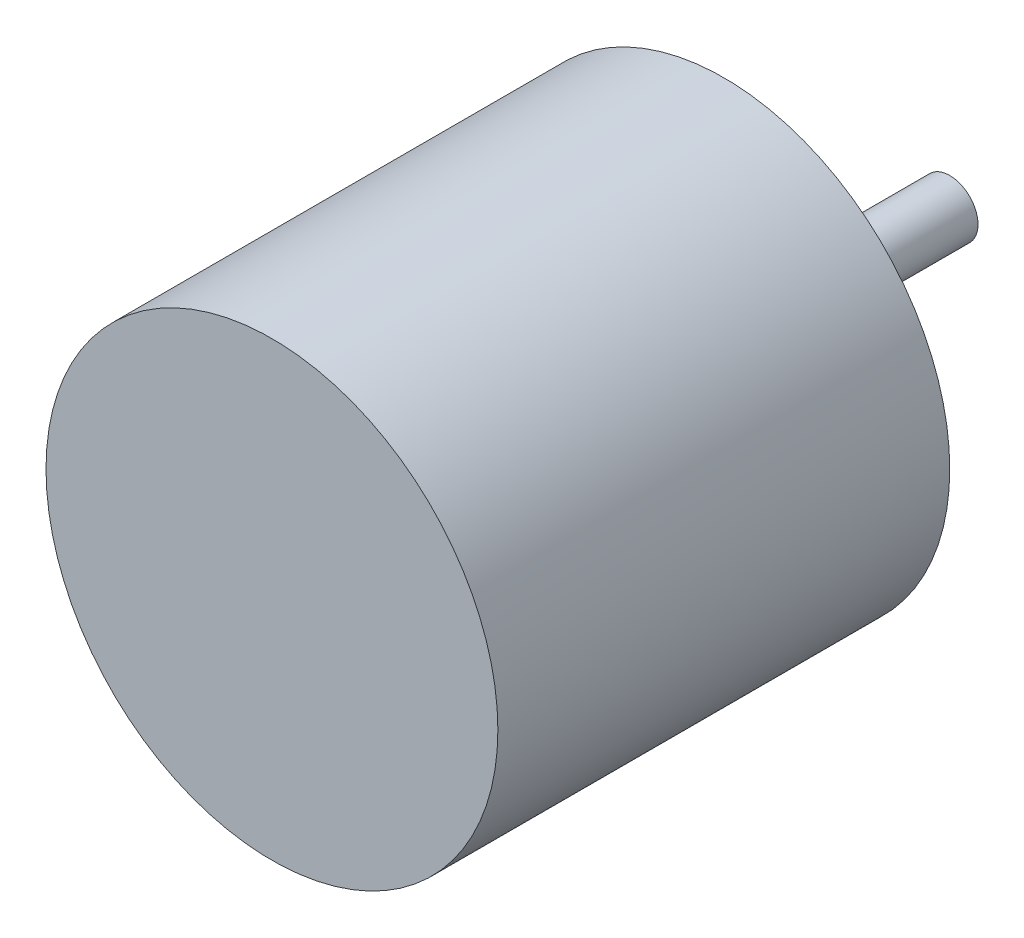
from build123d import *


with BuildPart() as part:
    # Sketch4 → Revolve1 (revolve)
    with BuildSketch(Plane(origin=(0, 0, 0), x_dir=(1, 0, 0), z_dir=(0, 1, 0)), mode=Mode.PRIVATE) as revolve1_sk:
        Polygon((0, 60), (-2.5, 60), (-2.5, 45), (-10, 45), (-10, 40), (-20, 40), (-20, 0), (0, 0), align=None)
    revolve(revolve1_sk.sketch.rotate(Axis((0, 0, 0), (0, 0, -1)), 180), axis=Axis((0, 0, 0), (0, 0, -1)))


solid = part.part
